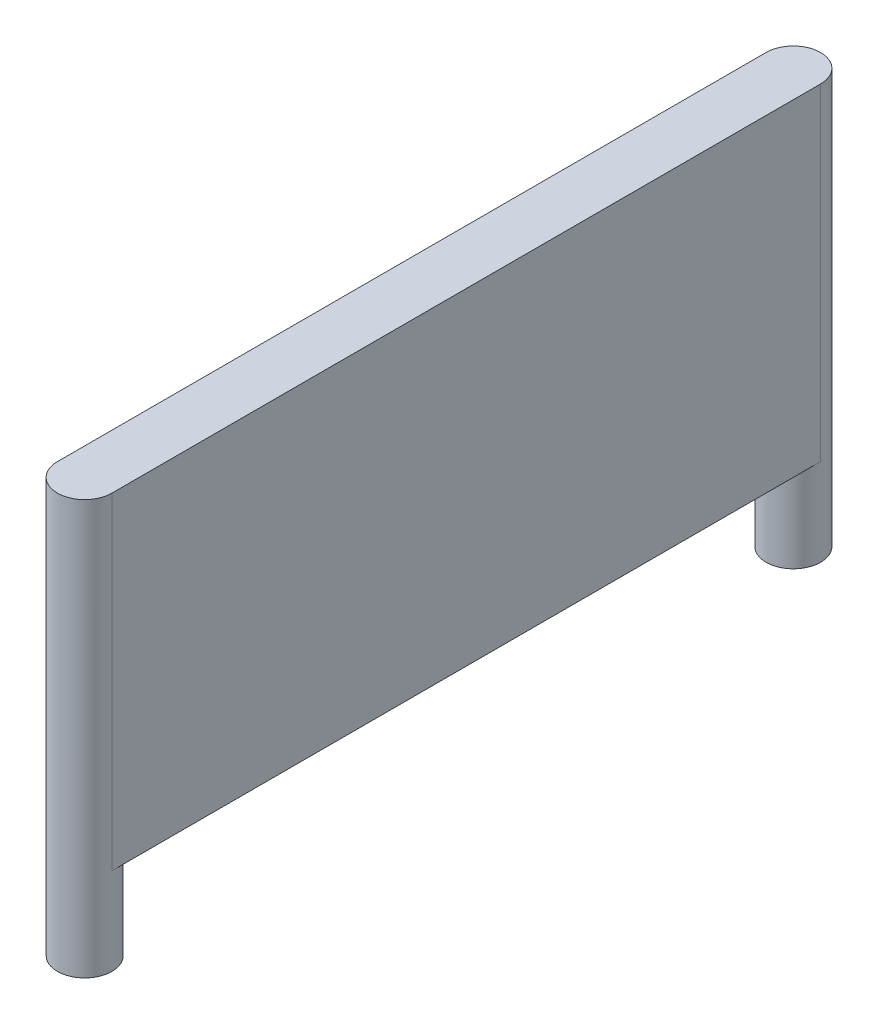
from build123d import *

# Parameters (mm, degrees)
BOSS_EXTRUDE1_DEPTH = 38.1
BOSS_EXTRUDE2_START = 10.16
SKETCH2_R           = 3.175
BOSS_EXTRUDE2_DEPTH = 10.16


with BuildPart() as part:
    # Sketch1 → Boss-Extrude1 (new body)
    with BuildSketch(Plane(origin=(0, 0, 0), x_dir=(1, 0, 0), z_dir=(0, 1, 0))):
        with BuildLine():
            Line((-3.175, 0), (-3.175, 82.55))
            ThreePointArc((-3.175, 82.55), (0, 85.725), (3.175, 82.55))
            Line((3.175, 82.55), (3.175, 0))
            ThreePointArc((3.175, 0), (0, -3.175), (-3.175, 0))
        make_face()
    extrude(amount=BOSS_EXTRUDE1_DEPTH)

    # Sketch2 → Boss-Extrude2 (add)
    with BuildSketch(Plane(origin=(0, 0, 0), x_dir=(-1, 0, 0), z_dir=(0, -1, 0)).offset(BOSS_EXTRUDE2_START)):
        with Locations(Location((0, 82.55, 0), (0, 0, 90))):
            Circle(SKETCH2_R)
        with Locations(Location((0, 0, 0), (0, 0, 90))):
            Circle(SKETCH2_R)
    extrude(amount=-BOSS_EXTRUDE2_DEPTH)


solid = part.part
